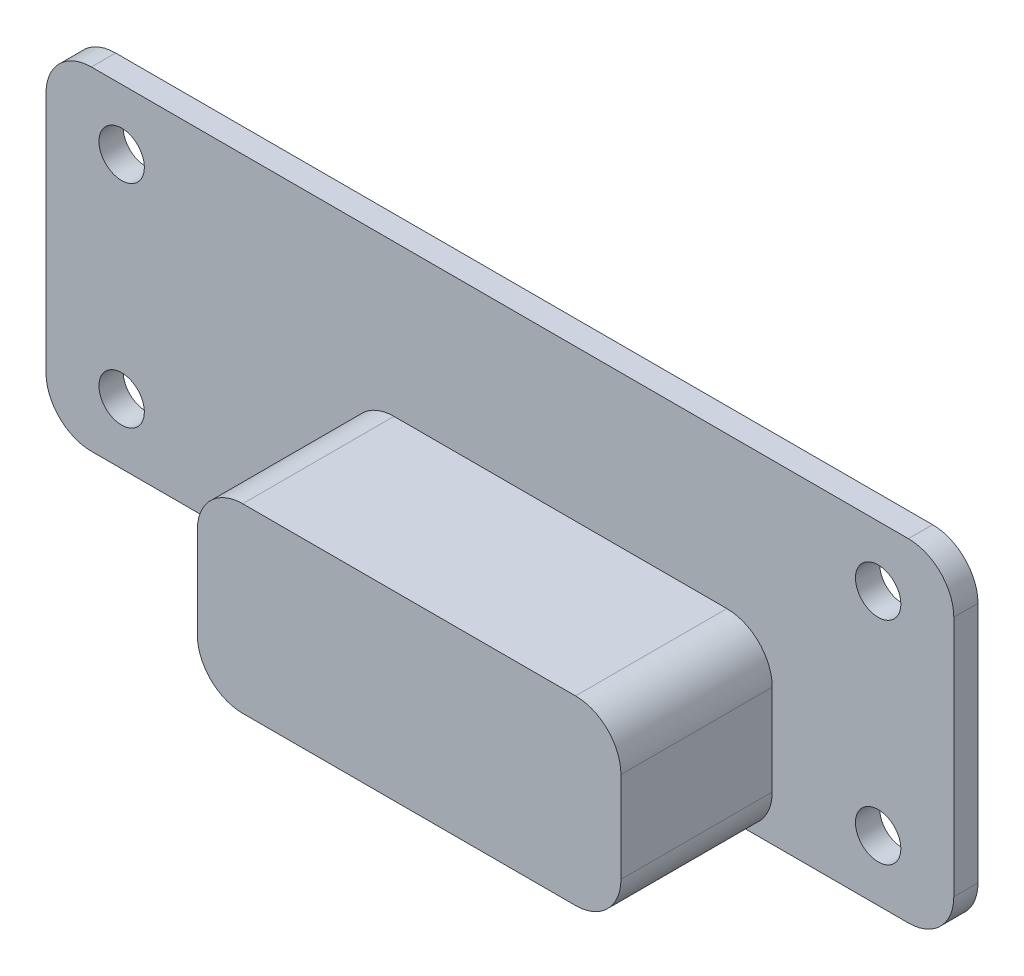
from build123d import *

# Parameters (mm, degrees)
SKETCH_1_R      = 1.5
EXTRUDE_1_DEPTH = 1.6
SKETCH_2_W      = 28
SKETCH_2_H      = 12
EXTRUDE_2_DEPTH = 10
FILLET_1_R      = 3


with BuildPart() as part:
    # 草图1 → 凸台-拉伸1 (new body)
    with BuildSketch(Plane.XY):
        with BuildLine():
            Line((-30, 8), (-30, -8))
            ThreePointArc((-30, -8), (-29.121320344, -10.121320344), (-27, -11))
            Line((-27, -11), (27, -11))
            ThreePointArc((27, -11), (29.121320344, -10.121320344), (30, -8))
            Line((30, -8), (30, 8))
            ThreePointArc((30, 8), (29.121320344, 10.121320344), (27, 11))
            Line((27, 11), (-27, 11))
            ThreePointArc((-27, 11), (-29.121320344, 10.121320344), (-30, 8))
        make_face()
        with Locations((-25, 7)):
            Circle(SKETCH_1_R, mode=Mode.SUBTRACT)
        with Locations((25, 7)):
            Circle(SKETCH_1_R, mode=Mode.SUBTRACT)
        with Locations((25, -7)):
            Circle(SKETCH_1_R, mode=Mode.SUBTRACT)
        with Locations((-25, -7)):
            Circle(SKETCH_1_R, mode=Mode.SUBTRACT)
    extrude(amount=EXTRUDE_1_DEPTH)

    # 草图2 → 凸台-拉伸2 (add)
    with BuildSketch(Plane.XY.offset(1.6)):
        with Locations((4, -5)):
            Rectangle(SKETCH_2_W, SKETCH_2_H)
    extrude(amount=EXTRUDE_2_DEPTH)

    # 圆角1
    fillet_1_edges = [part.edges().sort_by_distance(p)[0] for p in [
        (-10, 1, 6.6),
        (-10, -11, 6.6),
        (18, -11, 6.6),
        (18, 1, 6.6),
    ]]
    fillet(fillet_1_edges, radius=FILLET_1_R)


solid = part.part
